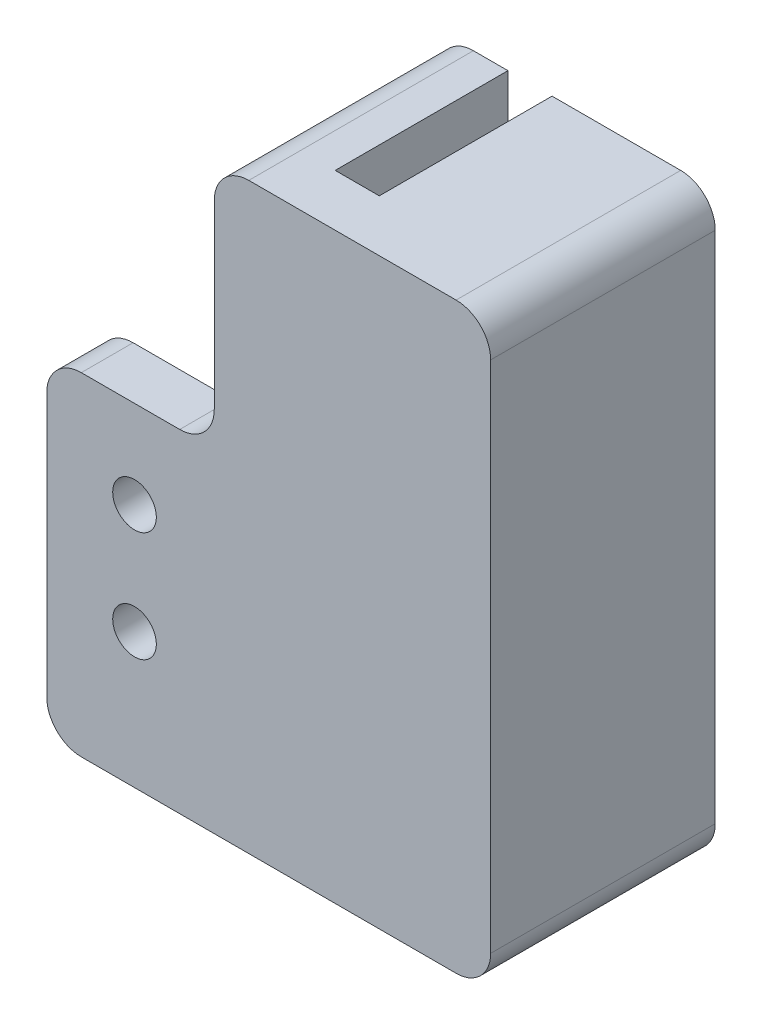
from build123d import *

# Parameters (mm, degrees)
BOSS_EXTRUDE1_DEPTH             = 26
SKETCH4_W                       = 32.5
SKETCH4_H                       = 67.5
CUT_EXTRUDE1_DEPTH              = 20
SKETCH5_R                       = 2.525
CUT_EXTRUDE2_DEPTH              = 557.471248134
SKETCH6_W                       = 8
SKETCH6_H                       = 67.5
BOSS_EXTRUDE2_DEPTH             = 20
FILLET3_R                       = 4
SKETCH9_R                       = 3.25
CUT_EXTRUDE3_DEPTH              = 5
M3X0_5_TAPPED_HOLE1_D           = 2.5
M3X0_5_TAPPED_HOLE1_DEPTH       = 10
M3X0_5_TAPPED_HOLE1_CSINK_D     = 3.05
M3X0_5_TAPPED_HOLE1_CSINK_ANGLE = 90
M3X0_5_TAPPED_HOLE1_TIP         = 0.751075774


with BuildPart() as part:
    # Sketch3 → Boss-Extrude1 (new body)
    with BuildSketch(Plane.XY):
        with BuildLine():
            Line((516, 38.526197832), (504.607604335, 38.526197832))
            ThreePointArc((504.607604335, 38.526197832), (501.779177211, 37.354624957), (500.607604335, 34.526197832))
            Line((500.607604335, 34.526197832), (500.607604335, 24))
            Line((500.607604335, 24), (500.607604335, 0))
            Line((500.607604335, 0), (516, 0))
            Line((516, 0), (552, 0))
            Line((552, 0), (552, 38.526197832))
            Line((552, 38.526197832), (552, 67.5))
            Line((552, 67.5), (520, 67.5))
            Line((520, 67.5), (520, 42.526197832))
            ThreePointArc((520, 42.526197832), (518.828427125, 39.697770708), (516, 38.526197832))
        make_face()
    extrude(amount=BOSS_EXTRUDE1_DEPTH)

    # Sketch4 → Cut-Extrude1 (cut)
    with BuildSketch(Plane(origin=(0, 0, 0), x_dir=(-1, 0, 0), z_dir=(0, 0, -1))):
        with Locations((-516.857604335, 33.75)):
            Rectangle(SKETCH4_W, SKETCH4_H)
    extrude(amount=-CUT_EXTRUDE1_DEPTH, mode=Mode.SUBTRACT)

    # Sketch5 → Cut-Extrude2 (cut, through all)
    with BuildSketch(Plane(origin=(0, 0, 20), x_dir=(-1, 0, 0), z_dir=(0, 0, -1))):
        with Locations((-510.767604335, 28.366197832)):
            Circle(SKETCH5_R)
        with Locations((-510.767604335, 15.636197832)):
            Circle(SKETCH5_R)
    extrude(amount=-CUT_EXTRUDE2_DEPTH, mode=Mode.SUBTRACT)

    # Sketch6 → Boss-Extrude2 (add)
    with BuildSketch(Plane(origin=(0, 0, 20), x_dir=(-1, 0, 0), z_dir=(0, 0, -1))):
        with Locations((-524, 33.75)):
            Rectangle(SKETCH6_W, SKETCH6_H)
    extrude(amount=BOSS_EXTRUDE2_DEPTH)

    # Fillet3
    fillet3_edges = [part.edges().sort_by_distance(p)[0] for p in [
        (520, 67.5, 13),
        (552, 67.5, 13),
        (552, 0, 13),
        (500.607604335, 0, 23),
        (520, 0, 10),
    ]]
    fillet(fillet3_edges, radius=FILLET3_R)

    # Sketch9 → Cut-Extrude3 (cut)
    with BuildSketch(Plane(origin=(0, 0, 0), x_dir=(-1, 0, 0), z_dir=(0, 0, -1))):
        with Locations((-523.5, 5)):
            Circle(SKETCH9_R)
        with Locations((-548.5, 5)):
            Circle(SKETCH9_R)
    extrude(amount=-CUT_EXTRUDE3_DEPTH, mode=Mode.SUBTRACT)

    # M3x0.5 Tapped Hole1
    with Locations(Plane(origin=(0, 0, 0), x_dir=(-1, 0, 0), z_dir=(0, 0, -1))):
        with Locations((-523.5, 57.5), (-548.5, 57.5), (-548.5, 22.5), (-523.5, 22.5)):
            CounterSinkHole(M3X0_5_TAPPED_HOLE1_D / 2, M3X0_5_TAPPED_HOLE1_CSINK_D / 2, depth=M3X0_5_TAPPED_HOLE1_DEPTH, counter_sink_angle=M3X0_5_TAPPED_HOLE1_CSINK_ANGLE)
            with Locations((0, 0, -(M3X0_5_TAPPED_HOLE1_DEPTH + M3X0_5_TAPPED_HOLE1_TIP / 2))):  # 118° drill point
                Cone(0, M3X0_5_TAPPED_HOLE1_D / 2, M3X0_5_TAPPED_HOLE1_TIP, mode=Mode.SUBTRACT)


solid = part.part
